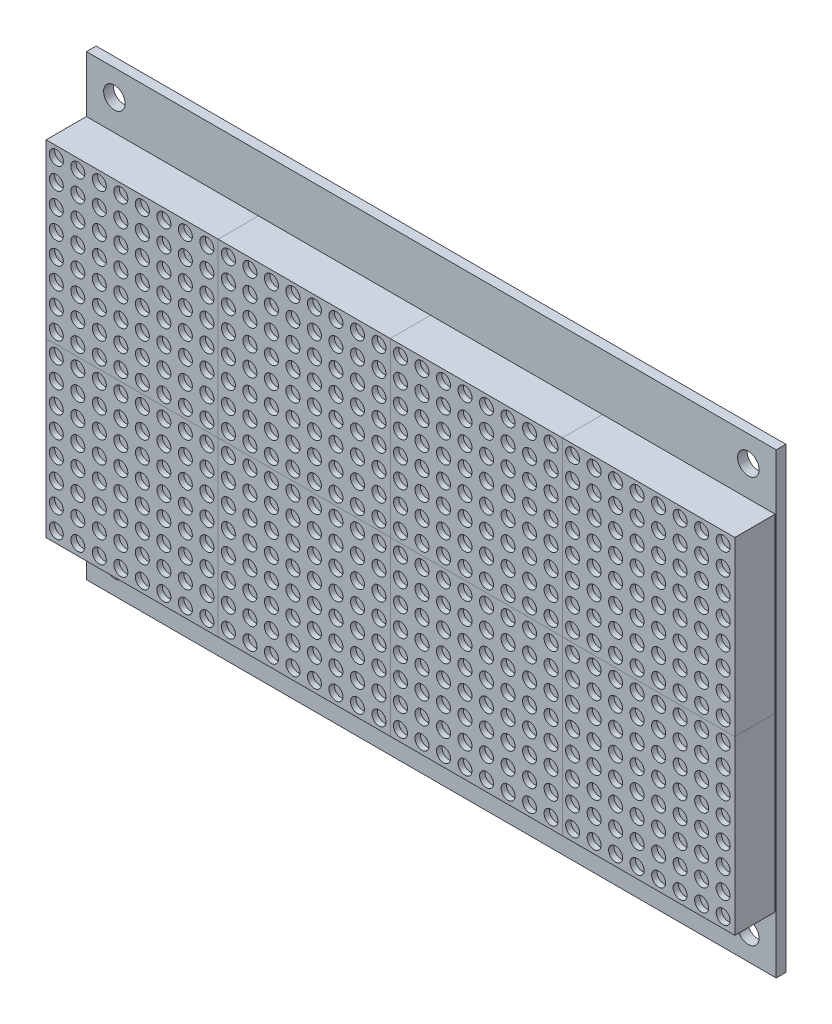
from build123d import *

# Parameters (mm, degrees)
SKETCH1_W           = 128.27
SKETCH1_H           = 85.05
SKETCH1_R           = 2
BOSS_EXTRUDE1_DEPTH = 1.8
SKETCH2_W           = 32.0675
SKETCH2_H           = 32.0675
BOSS_EXTRUDE2_DEPTH = 7.5
SKETCH3_R           = 1.3
CUT_EXTRUDE1_DEPTH  = 1
LPATTERN2_COUNT     = 4
LPATTERN2_PITCH     = 32
LPATTERN2_2_COUNT   = 2
LPATTERN2_2_PITCH   = 32
SKETCH4_W           = 30
SKETCH4_H           = 8.6
BOSS_EXTRUDE3_DEPTH = 17


with BuildPart() as part:
    # Sketch1 → Boss-Extrude1 (new body)
    with BuildSketch(Plane.XY):
        with Locations((64.135, 42.525)):
            Rectangle(SKETCH1_W, SKETCH1_H)
        with Locations((5.2, 80.25)):
            Circle(SKETCH1_R, mode=Mode.SUBTRACT)
        with Locations(Location((123.07, 80.25, 0), (0, 0, 180))):
            Circle(SKETCH1_R, mode=Mode.SUBTRACT)
        with Locations((123.07, 4.8)):
            Circle(SKETCH1_R, mode=Mode.SUBTRACT)
        with Locations(Location((5.2, 4.8, 0), (0, 0, 180))):
            Circle(SKETCH1_R, mode=Mode.SUBTRACT)
    extrude(amount=BOSS_EXTRUDE1_DEPTH)

    # Sketch4 → Boss-Extrude3 (add)
    with BuildSketch(Plane(origin=(0, 0, 0), x_dir=(-1, 0, 0), z_dir=(0, 0, -1))):
        with Locations((-27, 26.7)):
            Rectangle(SKETCH4_W, SKETCH4_H)
    extrude(amount=BOSS_EXTRUDE3_DEPTH)


with BuildPart() as body_2:
    # Sketch2 → Boss-Extrude2 (new body)
    with BuildSketch(Plane.XY.offset(1.8)):
        with Locations((16.03375, 58.55875)):
            Rectangle(SKETCH2_W, SKETCH2_H)
    extrude(amount=BOSS_EXTRUDE2_DEPTH)

    # Sketch3 → Cut-Extrude1 (cut)
    with BuildSketch(Plane.XY.offset(9.3)):
        with Locations((1.9, 72.6925)):
            Circle(SKETCH3_R)
        with Locations((5.9, 72.675)):
            Circle(SKETCH3_R)
        with Locations((9.9, 72.6575)):
            Circle(SKETCH3_R)
        with Locations((13.9, 72.64)):
            Circle(SKETCH3_R)
        with Locations((17.9, 72.6225)):
            Circle(SKETCH3_R)
        with Locations((21.9, 72.605)):
            Circle(SKETCH3_R)
        with Locations((25.9, 72.5875)):
            Circle(SKETCH3_R)
        with Locations((29.9, 72.57)):
            Circle(SKETCH3_R)
        with Locations((1.9, 68.675)):
            Circle(SKETCH3_R)
        with Locations((5.9, 68.6575)):
            Circle(SKETCH3_R)
        with Locations((9.9, 68.64)):
            Circle(SKETCH3_R)
        with Locations((13.9, 68.6225)):
            Circle(SKETCH3_R)
        with Locations((17.9, 68.605)):
            Circle(SKETCH3_R)
        with Locations((21.9, 68.5875)):
            Circle(SKETCH3_R)
        with Locations((25.9, 68.57)):
            Circle(SKETCH3_R)
        with Locations((29.9, 68.5525)):
            Circle(SKETCH3_R)
        with Locations((1.9, 64.6575)):
            Circle(SKETCH3_R)
        with Locations((5.9, 64.64)):
            Circle(SKETCH3_R)
        with Locations((9.9, 64.6225)):
            Circle(SKETCH3_R)
        with Locations((13.9, 64.605)):
            Circle(SKETCH3_R)
        with Locations((17.9, 64.5875)):
            Circle(SKETCH3_R)
        with Locations((21.9, 64.57)):
            Circle(SKETCH3_R)
        with Locations((25.9, 64.5525)):
            Circle(SKETCH3_R)
        with Locations((29.9, 64.535)):
            Circle(SKETCH3_R)
        with Locations((1.9, 60.64)):
            Circle(SKETCH3_R)
        with Locations((5.9, 60.6225)):
            Circle(SKETCH3_R)
        with Locations((9.9, 60.605)):
            Circle(SKETCH3_R)
        with Locations((13.9, 60.5875)):
            Circle(SKETCH3_R)
        with Locations((17.9, 60.57)):
            Circle(SKETCH3_R)
        with Locations((21.9, 60.5525)):
            Circle(SKETCH3_R)
        with Locations((25.9, 60.535)):
            Circle(SKETCH3_R)
        with Locations((29.9, 60.5175)):
            Circle(SKETCH3_R)
        with Locations((1.9, 56.6225)):
            Circle(SKETCH3_R)
        with Locations((5.9, 56.605)):
            Circle(SKETCH3_R)
        with Locations((9.9, 56.5875)):
            Circle(SKETCH3_R)
        with Locations((13.9, 56.57)):
            Circle(SKETCH3_R)
        with Locations((17.9, 56.5525)):
            Circle(SKETCH3_R)
        with Locations((21.9, 56.535)):
            Circle(SKETCH3_R)
        with Locations((25.9, 56.5175)):
            Circle(SKETCH3_R)
        with Locations((29.9, 56.5)):
            Circle(SKETCH3_R)
        with Locations((1.9, 52.605)):
            Circle(SKETCH3_R)
        with Locations((5.9, 52.5875)):
            Circle(SKETCH3_R)
        with Locations((9.9, 52.57)):
            Circle(SKETCH3_R)
        with Locations((13.9, 52.5525)):
            Circle(SKETCH3_R)
        with Locations((17.9, 52.535)):
            Circle(SKETCH3_R)
        with Locations((21.9, 52.5175)):
            Circle(SKETCH3_R)
        with Locations((25.9, 52.5)):
            Circle(SKETCH3_R)
        with Locations((29.9, 52.4825)):
            Circle(SKETCH3_R)
        with Locations((1.9, 48.5875)):
            Circle(SKETCH3_R)
        with Locations((5.9, 48.57)):
            Circle(SKETCH3_R)
        with Locations((9.9, 48.5525)):
            Circle(SKETCH3_R)
        with Locations((13.9, 48.535)):
            Circle(SKETCH3_R)
        with Locations((17.9, 48.5175)):
            Circle(SKETCH3_R)
        with Locations((21.9, 48.5)):
            Circle(SKETCH3_R)
        with Locations((25.9, 48.4825)):
            Circle(SKETCH3_R)
        with Locations((29.9, 48.465)):
            Circle(SKETCH3_R)
        with Locations((1.9, 44.57)):
            Circle(SKETCH3_R)
        with Locations((5.9, 44.5525)):
            Circle(SKETCH3_R)
        with Locations((9.9, 44.535)):
            Circle(SKETCH3_R)
        with Locations((13.9, 44.5175)):
            Circle(SKETCH3_R)
        with Locations((17.9, 44.5)):
            Circle(SKETCH3_R)
        with Locations((21.9, 44.4825)):
            Circle(SKETCH3_R)
        with Locations((25.9, 44.465)):
            Circle(SKETCH3_R)
        with Locations((29.9, 44.4475)):
            Circle(SKETCH3_R)
    extrude(amount=-CUT_EXTRUDE1_DEPTH, mode=Mode.SUBTRACT)


with BuildPart() as lpattern2_1:
    # LPattern2: pattern copy
    add(body_2.part.moved(Location(Vector(1, 0, 0) * (1 * LPATTERN2_PITCH))))


with BuildPart() as lpattern2_2:
    # LPattern2: pattern copy
    add(body_2.part.moved(Location(Vector(1, 0, 0) * (2 * LPATTERN2_PITCH))))


with BuildPart() as lpattern2_3:
    # LPattern2: pattern copy
    add(body_2.part.moved(Location(Vector(1, 0, 0) * (3 * LPATTERN2_PITCH))))


with BuildPart() as lpattern2_2_1:
    # LPattern2 2: pattern copy
    add(body_2.part.moved(Location(Vector(0, -1, 0) * (1 * LPATTERN2_2_PITCH))))


with BuildPart() as lpattern2_2_2:
    # LPattern2 2: pattern copy
    add(lpattern2_1.part.moved(Location(Vector(0, -1, 0) * (1 * LPATTERN2_2_PITCH))))


with BuildPart() as lpattern2_2_3:
    # LPattern2 2: pattern copy
    add(lpattern2_2.part.moved(Location(Vector(0, -1, 0) * (1 * LPATTERN2_2_PITCH))))


with BuildPart() as lpattern2_2_4:
    # LPattern2 2: pattern copy
    add(lpattern2_3.part.moved(Location(Vector(0, -1, 0) * (1 * LPATTERN2_2_PITCH))))


solid = Compound([part.part, body_2.part, lpattern2_1.part, lpattern2_2.part, lpattern2_3.part, lpattern2_2_1.part, lpattern2_2_2.part, lpattern2_2_3.part, lpattern2_2_4.part])
